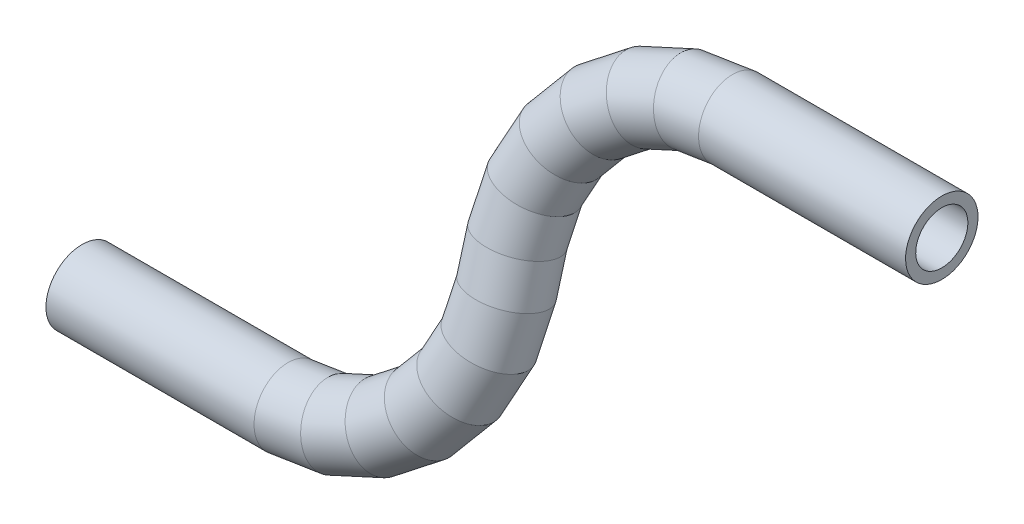
from build123d import *

# Parameters (mm, degrees)
PROFILE_R   = 3.175
PROFILE_R_2 = 2.286


with BuildPart() as part:
    # Tube: sweep along a curve in space
    with BuildLine() as tube_path:
        Line((-2754.892778381, -26.697560814, -19.396913326), (-2773.092778381, -26.697560814, -19.396913326))
        Line((-2773.092778381, -26.697560814, -19.396913326), (-2776.975064057, -27.190103161, -19.260391779))
        Line((-2776.975064057, -27.190103161, -19.260391779), (-2780.592778381, -28.634164253, -18.860130858))
        Line((-2780.592778381, -28.634164253, -18.860130858), (-2783.699380099, -30.931333715, -18.223407683))
        Line((-2783.699380099, -30.931333715, -18.223407683), (-2786.083159438, -33.925063243, -17.393613884))
        Line((-2786.083159438, -33.925063243, -17.393613884), (-2787.581665775, -37.411335117, -16.42729854))
        Line((-2787.581665775, -37.411335117, -16.42729854), (-2788.092778381, -41.152565671, -15.390314443))
        Line((-2788.092778381, -41.152565671, -15.390314443), (-2788.092778381, -44.633460324, -14.425489542))
        Line((-2788.092778381, -44.633460324, -14.425489542), (-2788.603890986, -48.374690878, -13.388505446))
        Line((-2788.603890986, -48.374690878, -13.388505446), (-2790.102397324, -51.860962753, -12.422190101))
        Line((-2790.102397324, -51.860962753, -12.422190101), (-2792.486176663, -54.85469228, -11.592396303))
        Line((-2792.486176663, -54.85469228, -11.592396303), (-2795.592778381, -57.151861742, -10.955673127))
        Line((-2795.592778381, -57.151861742, -10.955673127), (-2799.210492704, -58.595922834, -10.555412206))
        Line((-2799.210492704, -58.595922834, -10.555412206), (-2803.092778381, -59.088465181, -10.41889066))
        Line((-2803.092778381, -59.088465181, -10.41889066), (-2821.292778381, -59.088465181, -10.41889066))
    # Profile → Tube (sweep)
    with BuildSketch(Plane(origin=(-2754.892778381, 0, 0), x_dir=(0, 0, -1), z_dir=(1, 0, 0))):
        with Locations((19.396913326, -26.697560814)):
            Circle(PROFILE_R)
        with Locations((19.396913326, -26.697560814)):
            Circle(PROFILE_R_2, mode=Mode.SUBTRACT)
    sweep(path=tube_path.line, transition=Transition.RIGHT)


solid = part.part
